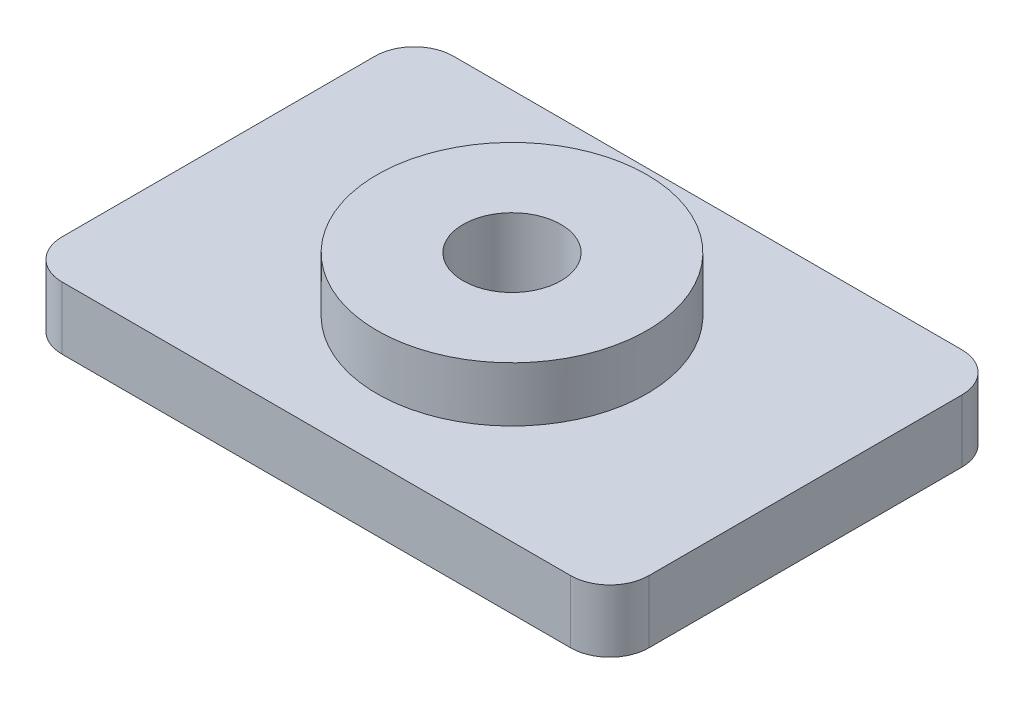
from build123d import *

# Parameters (mm, degrees)
SALIENTE_EXTRUIR1_DEPTH = 1.6
CROQUIS2_R              = 3.45
SALIENTE_EXTRUIR2_DEPTH = 1.4
CORTAR_EXTRUIR1_REACH   = 20.276
CROQUIS3_R              = 1.25


with BuildPart() as part:
    # Croquis1 → Saliente-Extruir1 (new body)
    with BuildSketch(Plane(origin=(0, 0, 0), x_dir=(1, 0, 0), z_dir=(0, 1, 0))):
        with BuildLine():
            Line((1, 0), (14, 0))
            ThreePointArc((14, 0), (14.707106781, 0.292893219), (15, 1))
            Line((15, 1), (15, 9))
            ThreePointArc((15, 9), (14.707106781, 9.707106781), (14, 10))
            Line((14, 10), (1, 10))
            ThreePointArc((1, 10), (0.292893219, 9.707106781), (0, 9))
            Line((0, 9), (0, 1))
            ThreePointArc((0, 1), (0.292893219, 0.292893219), (1, 0))
        make_face()
    extrude(amount=SALIENTE_EXTRUIR1_DEPTH)

    # Croquis2 → Saliente-Extruir2 (add)
    with BuildSketch(Plane(origin=(0, 1.6, 0), x_dir=(1, 0, 0), z_dir=(0, 1, 0))):
        with Locations(Location((7.5, 5, 0), (0, 0, 90))):
            Circle(CROQUIS2_R)
    extrude(amount=SALIENTE_EXTRUIR2_DEPTH)

    # Croquis3 → Cortar-Extruir1 (cut, up to next)
    with BuildSketch(Plane(origin=(0, 3, 0), x_dir=(1, 0, 0), z_dir=(0, 1, 0)), mode=Mode.PRIVATE) as cortar_extruir1_sk1:
        with Locations(Location((7.5, 5, 0), (0, 0, 270))):
            Circle(CROQUIS3_R)
    cortar_extruir1_tool1 = extrude(cortar_extruir1_sk1.sketch, amount=-CORTAR_EXTRUIR1_REACH, mode=Mode.PRIVATE) & part.part
    add(cortar_extruir1_tool1.solids().sort_by_distance((7.5, 3, -5))[0], mode=Mode.SUBTRACT)


solid = part.part
